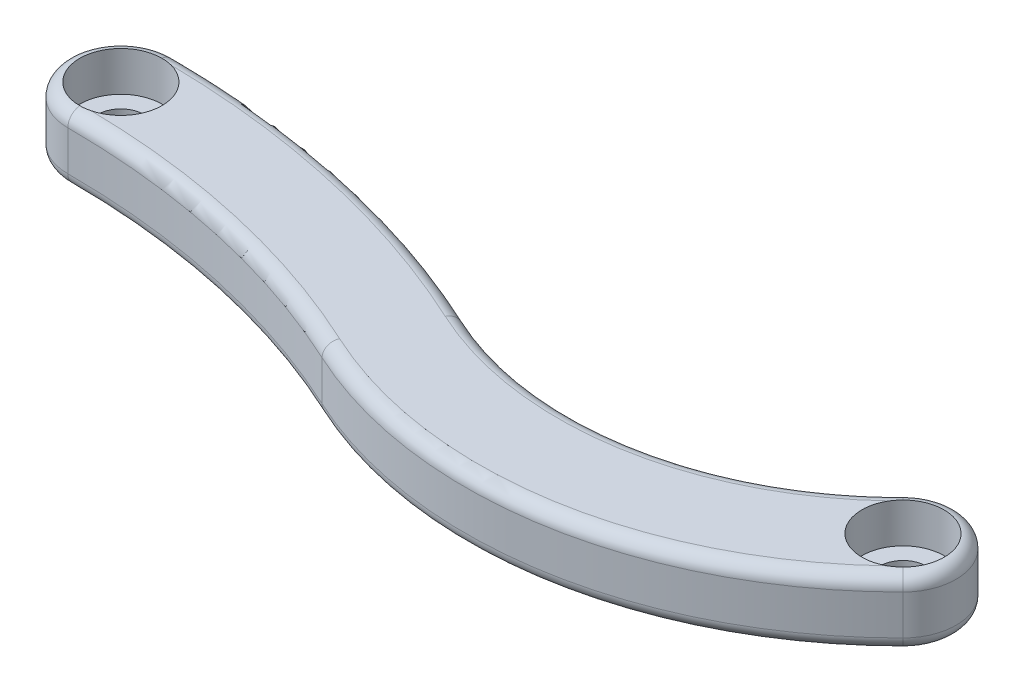
from build123d import *

# Parameters (mm, degrees)
SKETCH1_R           = 1.75
BOSS_EXTRUDE1_DEPTH = 5
FILLET1_R           = 1
SKETCH2_R           = 3.1
CUT_EXTRUDE1_DEPTH  = 3
SKETCH3_W           = 83.675621306
SKETCH3_H           = 27.808708761
CUT_EXTRUDE2_DEPTH  = 5


with BuildPart() as part:
    # Sketch1 → Boss-Extrude1 (new body)
    with BuildSketch(Plane(origin=(0, 0, 0), x_dir=(1, 0, 0), z_dir=(0, 1, 0))):
        with BuildLine():
            ThreePointArc((-29.5, 4), (-33.5, 0), (-29.5, -4))
            ThreePointArc((-29.5, -4), (-16.900654795, -5.373538993), (-4.893229568, -9.429626812))
            ThreePointArc((-4.893229568, -9.429626812), (14.756477238, -11.986867848), (32.328427125, -2.828427125))
            ThreePointArc((32.328427125, -2.828427125), (32.328427125, 2.828427125), (26.671572875, 2.828427125))
            ThreePointArc((26.671572875, 2.828427125), (13.359489628, -4.109785544), (-1.526651892, -2.172481729))
            ThreePointArc((-1.526651892, -2.172481729), (-15.176874162, 2.438540137), (-29.5, 4))
        make_face()
        with Locations(Location((-29.5, 0, 0), (0, 0, 270))):
            Circle(SKETCH1_R, mode=Mode.SUBTRACT)
        with Locations(Location((29.5, 0, 0), (0, 0, 270))):
            Circle(SKETCH1_R, mode=Mode.SUBTRACT)
    extrude(amount=BOSS_EXTRUDE1_DEPTH)

    # Fillet1
    fillet1_edges = [part.edges().sort_by_distance(p)[0] for p in [
        (-16.900654795, 5, 5.373538993),
        (14.756477238, 5, 11.986867848),
        (32.328427125, 5, -2.828427125),
        (13.359489628, 5, 4.109785544),
        (-15.176874162, 5, -2.438540137),
        (13.359489628, 0, 4.109785544),
        (32.328427125, 0, -2.828427125),
        (14.756477238, 0, 11.986867848),
        (-16.900654795, 0, 5.373538993),
        (-33.5, 0, 0),
        (-15.176874162, 0, -2.438540137),
        (-33.5, 5, 0),
    ]]
    fillet(fillet1_edges, radius=FILLET1_R)

    # Sketch2 → Cut-Extrude1 (cut)
    with BuildSketch(Plane.XZ):
        with Locations(Location((29.5, 0, 0), (0, 0, 270))):
            Circle(SKETCH2_R)
        with Locations(Location((-29.5, 0, 0), (0, 0, 270))):
            Circle(SKETCH2_R)
    extrude(amount=-CUT_EXTRUDE1_DEPTH, mode=Mode.SUBTRACT)


with BuildPart() as body_2:
    # Mirror1: mirrored copy
    add(part.part.mirror(Plane(origin=(0, -10, 0), x_dir=(0, 0, 1), z_dir=(0, -1, 0))))


with BuildPart() as part_1:
    add(part.part)

    # Sketch3 → Cut-Extrude2 (cut)
    with BuildSketch(Plane.XZ):
        with Locations((4.363579438, 1.855920518)):
            Rectangle(SKETCH3_W, SKETCH3_H)
    extrude(amount=-CUT_EXTRUDE2_DEPTH, mode=Mode.SUBTRACT)


solid = body_2.part
